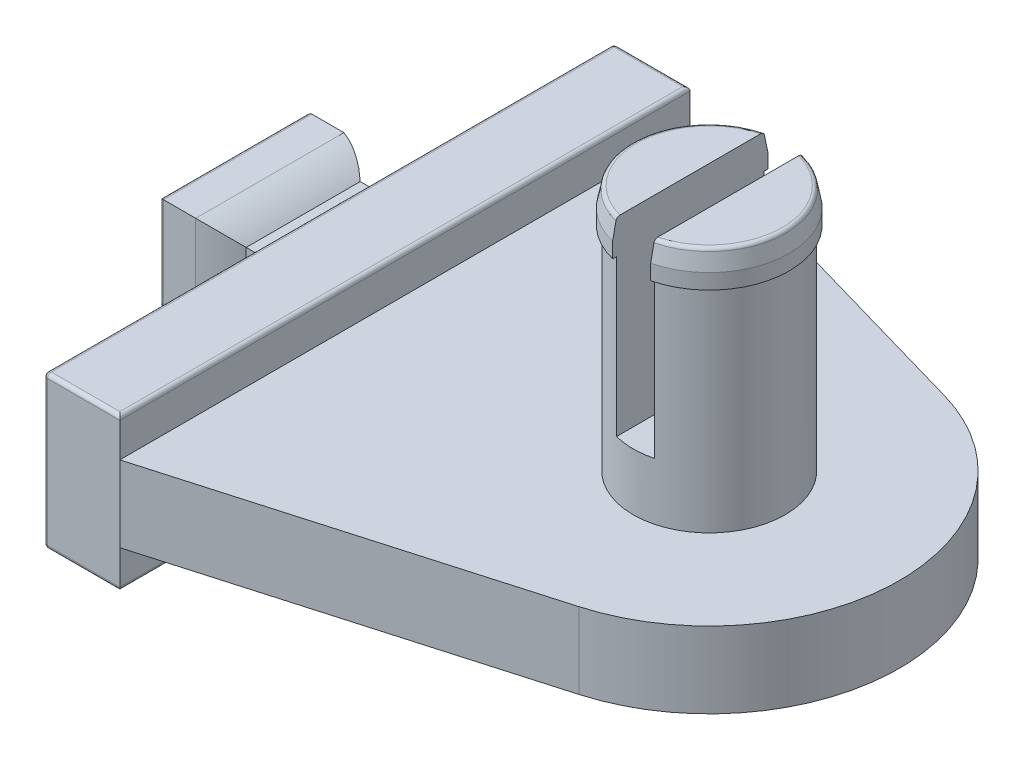
from build123d import *

# Parameters (mm, degrees)
EXTRUDE_1_DEPTH          = 1
EXTRUDE_1_DEPTH_BACK     = 1
SKETCH_3_W               = 2
SKETCH_3_H               = 15
EXTRUDE_2_DEPTH          = 1
SKETCH_4_R               = 2
EXTRUDE_3_DEPTH          = 6.5
SKETCH_6_W               = 1
SKETCH_6_H               = 6
CUT_EXTRUDE_1_DEPTH      = 5
EXTRUDE_4_DEPTH          = 3
EXTRUDE_4_DEPTH_BACK     = 3
CUT_EXTRUDE_2_DEPTH      = 5
CUT_EXTRUDE_2_DEPTH_BACK = 5
FILLET_2_R               = 0.1
FILLET_4_R               = 0.1


with BuildPart() as part:
    # 草图1 → 凸台-拉伸1 (new, two sides: drawn at the far end of the back side and taken through both)
    with BuildSketch(Plane(origin=(0, 0, 0), x_dir=(1, 0, 0), z_dir=(0, 1, 0)).offset(-EXTRUDE_1_DEPTH_BACK)):
        with BuildLine():
            Line((0, -7.5), (0, 7.5))
            Line((0, 7.5), (2, 7.5))
            Line((2, 7.5), (11.380335961, 4.805691692))
            ThreePointArc((11.380335961, 4.805691692), (15, 0), (11.380335961, -4.805691692))
            Line((11.380335961, -4.805691692), (2, -7.5))
            Line((2, -7.5), (0, -7.5))
        make_face()
    extrude(amount=EXTRUDE_1_DEPTH + EXTRUDE_1_DEPTH_BACK)

    # 草图3 → 凸台-拉伸2 (add)
    with BuildSketch(Plane(origin=(0, 1, 0), x_dir=(1, 0, 0), z_dir=(0, 1, 0))):
        with Locations((1, 0)):
            Rectangle(SKETCH_3_W, SKETCH_3_H)
    extrude_2 = extrude(amount=EXTRUDE_2_DEPTH)

    # 镜向1: 凸台-拉伸2 across plane
    add(extrude_2.mirror(Plane.ZX))

    # 草图4 → 凸台-拉伸3 (add)
    with BuildSketch(Plane(origin=(0, 1, 0), x_dir=(1, 0, 0), z_dir=(0, 1, 0))):
        with Locations((10, 0)):
            Circle(SKETCH_4_R)
    extrude(amount=EXTRUDE_3_DEPTH)

    # 草图5 → 旋转1 (revolve)
    with BuildSketch(Plane.XY):
        Polygon((8, 7.5), (8, 6.6), (7.9, 6.6), (7.9, 7), align=None)
    revolve(axis=Axis((10, 7.5, 0), (0, -1, 0)))

    # 草图6 → 切除-拉伸1 (cut)
    with BuildSketch(Plane(origin=(0, 7.5, 0), x_dir=(1, 0, 0), z_dir=(0, 1, 0))):
        with Locations((10, 0)):
            Rectangle(SKETCH_6_W, SKETCH_6_H)
    extrude(amount=-CUT_EXTRUDE_1_DEPTH, mode=Mode.SUBTRACT)

    # 草图7 → 凸台-拉伸4 (add, two sides: drawn at the far end of the back side and taken through both)
    with BuildSketch(Plane(origin=(0, 0, 0), x_dir=(1, 0, 0), z_dir=(0, 1, 0)).offset(-EXTRUDE_4_DEPTH_BACK)):
        with BuildLine():
            Line((0, -1.5), (0, 1.5))
            Line((0, 1.5), (-0.677124344, 1.5))
            ThreePointArc((-0.677124344, 1.5), (-1.088161527, 1.780042303), (-1.555590279, 1.95))
            Line((-1.555590279, 1.95), (-2.5, 1.95))
            Line((-2.5, 1.95), (-2.5, -1.95))
            Line((-2.5, -1.95), (-1.555590279, -1.95))
            ThreePointArc((-1.555590279, -1.95), (-1.088161527, -1.780042303), (-0.677124344, -1.5))
            Line((-0.677124344, -1.5), (0, -1.5))
        make_face()
    extrude(amount=EXTRUDE_4_DEPTH + EXTRUDE_4_DEPTH_BACK)

    # 草图8 → 切除-拉伸2 (cut, two sides: drawn at the far end of the back side and taken through both)
    with BuildSketch(Plane.XY.offset(-CUT_EXTRUDE_2_DEPTH_BACK)):
        with BuildLine():
            Line((0, -3), (0, -1.5))
            Line((0, -1.5), (-0.677124344, -1.5))
            ThreePointArc((-0.677124344, -1.5), (-1.088161527, -1.780042303), (-1.555590279, -1.95))
            Line((-1.555590279, -1.95), (-2.5, -1.95))
            Line((-2.5, -1.95), (-2.5, -3))
            Line((-2.5, -3), (0, -3))
        make_face()
        with BuildLine():
            Line((0, 1.5), (-0.677124344, 1.5))
            ThreePointArc((-0.677124344, 1.5), (-1.088161527, 1.780042303), (-1.555590279, 1.95))
            Line((-1.555590279, 1.95), (-2.5, 1.95))
            Line((-2.5, 1.95), (-2.5, 3))
            Line((-2.5, 3), (0, 3))
            Line((0, 3), (0, 1.5))
        make_face()
    extrude(amount=CUT_EXTRUDE_2_DEPTH + CUT_EXTRUDE_2_DEPTH_BACK, mode=Mode.SUBTRACT)

    # 圆角2
    fillet_2_edges = [part.edges().sort_by_distance(p)[0] for p in [
        (-2.5, 0, 1.95),
        (-2.5, -1.95, 0),
        (-2.5, 0, -1.95),
        (-2.5, 1.95, 0),
        (8, 7.5, 0),
        (12, 7.5, 0),
    ]]
    fillet(fillet_2_edges, radius=FILLET_2_R)

    # 圆角4
    fillet_4_edges = [part.edges().sort_by_distance(p)[0] for p in [
        (1, -2, -7.5),
        (2, -2, 0),
        (1, -2, 7.5),
        (2, 2, 0),
        (1, 2, 7.5),
        (1, 2, -7.5),
        (0, 0, -7.5),
        (0, 0, 7.5),
        (0, -2, 0),
        (0, 2, 0),
    ]]
    fillet(fillet_4_edges, radius=FILLET_4_R)


solid = part.part
